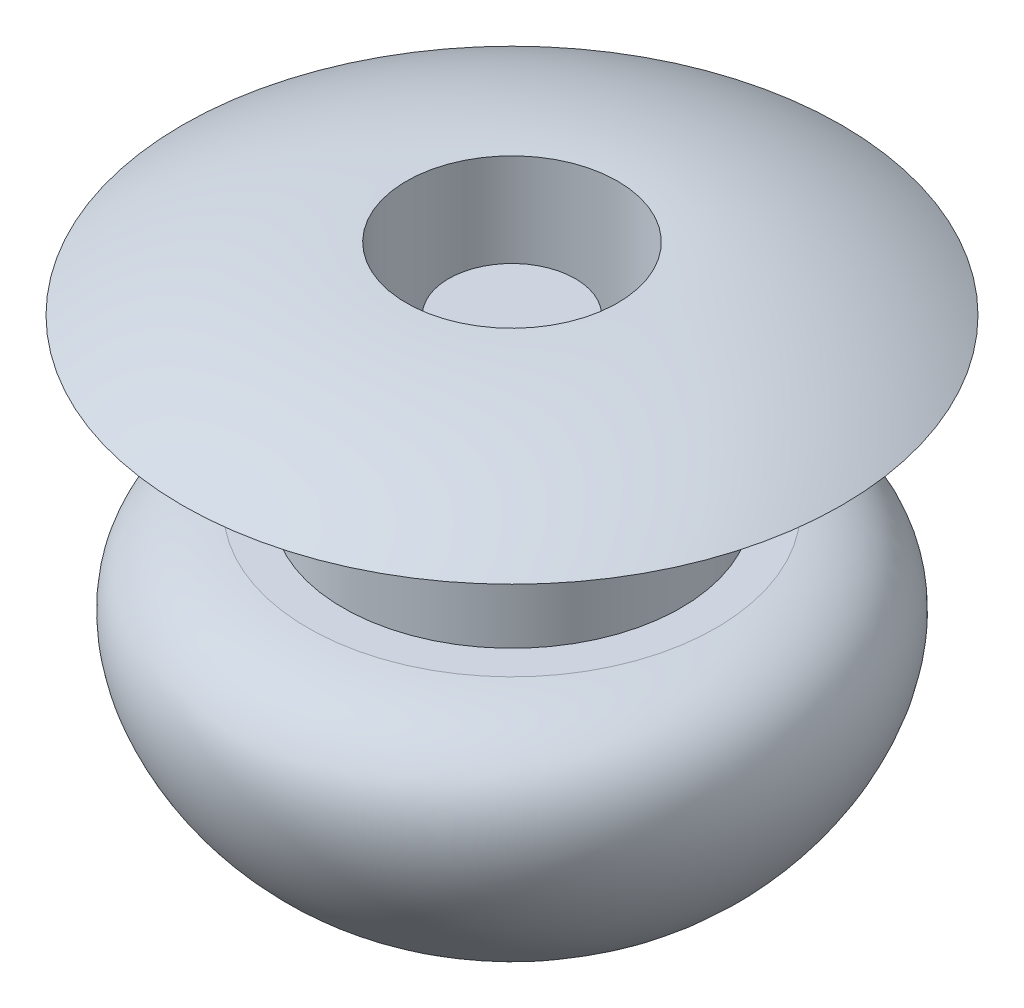
from build123d import *


with BuildPart() as part:
    # Szkic1 → Obrót1 (revolve)
    with BuildSketch(Plane(origin=(0, 0, 0), x_dir=(0, 0, -1), z_dir=(1, 0, 0)), mode=Mode.PRIVATE) as obr_t1_sk:
        with BuildLine():
            Line((0, 0), (-0.75, 0))
            Line((-0.75, 0), (-0.75, -2.200738523))
            Line((-0.75, -2.200738523), (-1.25, -2.200738523))
            Line((-1.25, -2.200738523), (-1.25, 0.75))
            ThreePointArc((-1.25, 0.75), (-2.627043935, 0.558888572), (-3.9, 0))
            Line((-3.9, 0), (-2, 0))
            Line((-2, 0), (-2, -2))
            Line((-2, -2), (-2.413891755, -2))
            add(Edge.make_bspline(
                [(-2.413891755, -2), (-3.867503112, -2.169657322), (-3.528877649, -4.302013626), (-1.083961642, -5.873532369), (-0.271752618, -3.874949298), (-0.956030427, -3.578929194)],
                knots=[0, 0, 0, 0, 0.464993082, 0.721927553, 1, 1, 1, 1], degree=3))
            add(Edge.make_bspline(
                [(-0.956030427, -3.578929194), (-0.520263876, -3.700738523), (0, -3.700738523)],
                knots=[0.992852221, 0.992852221, 0.992852221, 1.570796327, 1.570796327, 1.570796327], degree=2, weights=[1, 0.958537313, 1]))
            Line((0, -3.700738523), (0, -2.200738523))
            Line((0, -2.200738523), (0, 0))
        make_face()
    revolve(obr_t1_sk.sketch.rotate(Axis((0, 0, 0), (0, 1, 0)), 180), axis=Axis((0, 0, 0), (0, 1, 0)))


solid = part.part
